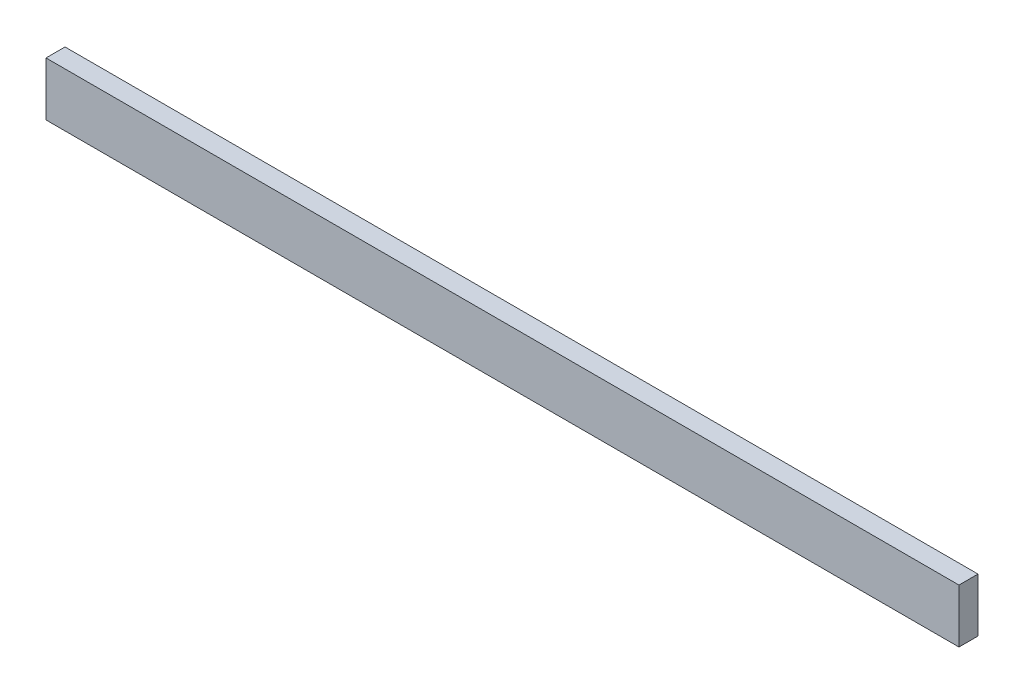
from build123d import *

# Parameters (mm, degrees)
SKETCH1_W           = 215.9
SKETCH1_H           = 4.5
BOSS_EXTRUDE1_DEPTH = 12.7


with BuildPart() as part:
    # Sketch1 → Boss-Extrude1 (new body)
    with BuildSketch(Plane(origin=(0, 0, 0), x_dir=(1, 0, 0), z_dir=(0, 1, 0))):
        with Locations((107.95, 2.25)):
            Rectangle(SKETCH1_W, SKETCH1_H)
    extrude(amount=BOSS_EXTRUDE1_DEPTH)


solid = part.part
